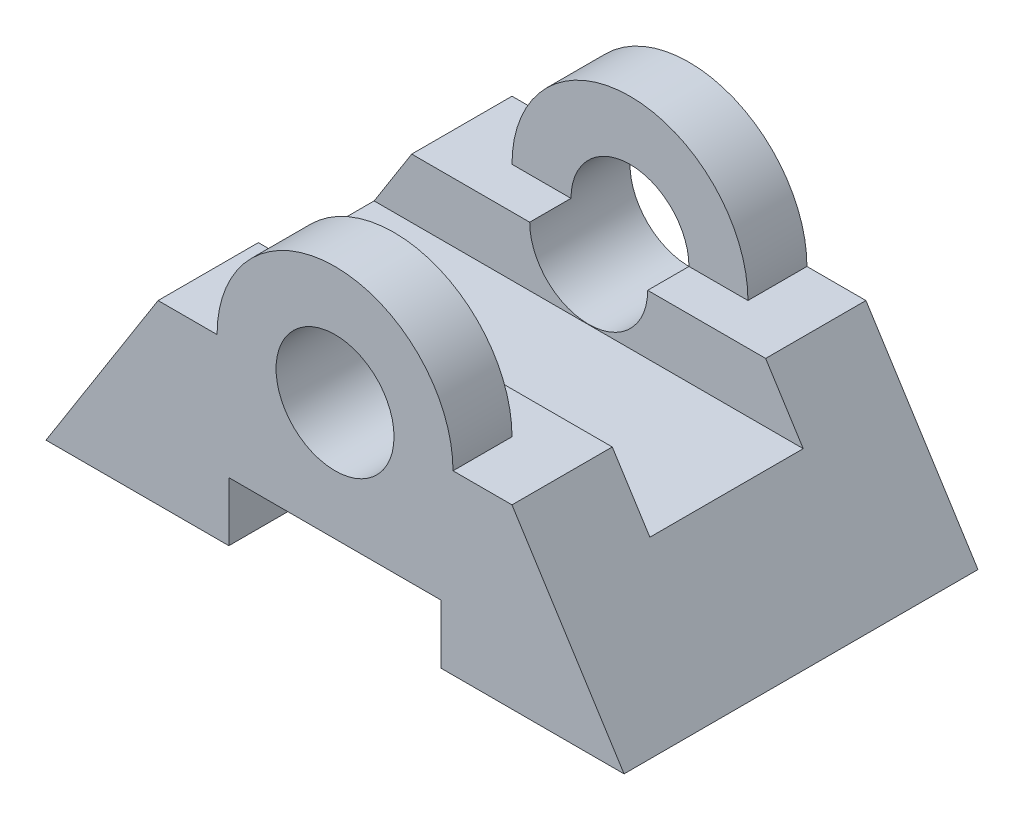
from build123d import *

# Parameters (mm, degrees)
BOSS_EXTRUDE1_DEPTH     = 60
CUT_EXTRUDE1_DEPTH      = 104.638795825
CUT_EXTRUDE1_DEPTH_BACK = 104.638795825
BOSS_EXTRUDE2_DEPTH     = 10
SKETCH5_R               = 10
CUT_EXTRUDE2_DEPTH      = 93.200867675


with BuildPart() as part:
    # Sketch1 → Boss-Extrude1 (new body)
    with BuildSketch(Plane.XY):
        Polygon((-30, 30), (-49, 0), (-18, 0), (-18, 10), (0, 10), (0, 30), (-20, 30), align=None)
        Polygon((20, 30), (0, 30), (0, 10), (18, 10), (18, 0), (49, 0), (30, 30), align=None)
    extrude(amount=-BOSS_EXTRUDE1_DEPTH)

    # Sketch3 → Cut-Extrude1 (cut, two sides: drawn at the far end of the back side and taken through both)
    with BuildSketch(Plane(origin=(30, 0, 0), x_dir=(0, 0, -1), z_dir=(1, 0, 0)).offset(-CUT_EXTRUDE1_DEPTH_BACK)):
        Polygon((17, 144.861813831), (17, 30), (17, 19.936985668), (43, 19.936985668), (43, 30), (43, 144.861813831), (43, 374.585441494), (17, 374.585441494), align=None)
    extrude(amount=CUT_EXTRUDE1_DEPTH + CUT_EXTRUDE1_DEPTH_BACK, mode=Mode.SUBTRACT)

    # Sketch4 → Boss-Extrude2 (add)
    with BuildSketch(Plane.XY):
        with BuildLine():
            Line((-20, 30), (20, 30))
            ThreePointArc((20, 30), (0, 50), (-20, 30))
        make_face()
    boss_extrude2 = extrude(amount=-BOSS_EXTRUDE2_DEPTH)

    # Sketch5 → Cut-Extrude2 (cut, through all)
    with BuildSketch(Plane.XY):
        with Locations((0, 30)):
            Circle(SKETCH5_R)
    cut_extrude2 = extrude(amount=-CUT_EXTRUDE2_DEPTH, mode=Mode.SUBTRACT)

    # Mirror1: Boss-Extrude2 across plane
    add(boss_extrude2.mirror(Plane.XY.offset(-30)))

    # Mirror2: Cut-Extrude2 across plane
    add(cut_extrude2.mirror(Plane.XY.offset(-30)), mode=Mode.SUBTRACT)


solid = part.part
